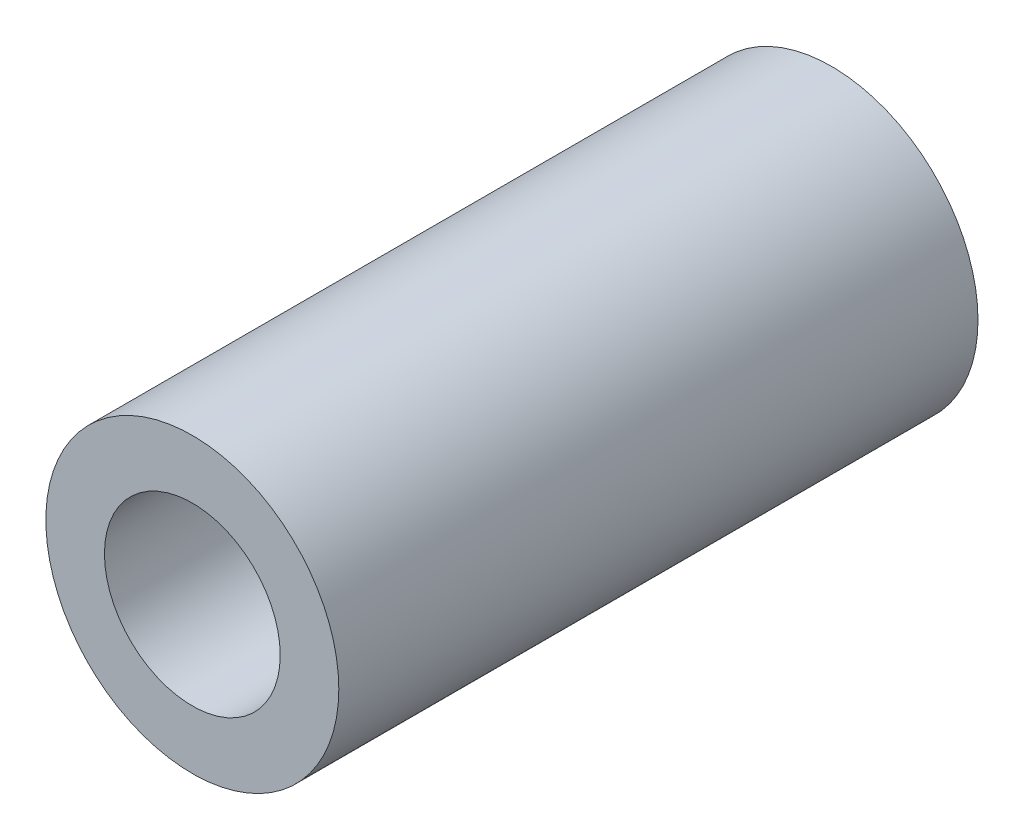
from build123d import *

# Parameters (mm, degrees)
SKETCH_1_R         = 2.75
EXTRUDE_1_DEPTH    = 12
HOLE_WIZARD_M4_1_D = 3.3


with BuildPart() as part:
    # 草图1 → 凸台-拉伸1 (new body)
    with BuildSketch(Plane.XY):
        Circle(SKETCH_1_R)
    extrude(amount=EXTRUDE_1_DEPTH)

    # M4 螺纹孔1 (through all)
    with Locations(Plane.XY.offset(12)):
        with Locations((0, 0)):
            Hole(HOLE_WIZARD_M4_1_D / 2)


solid = part.part
